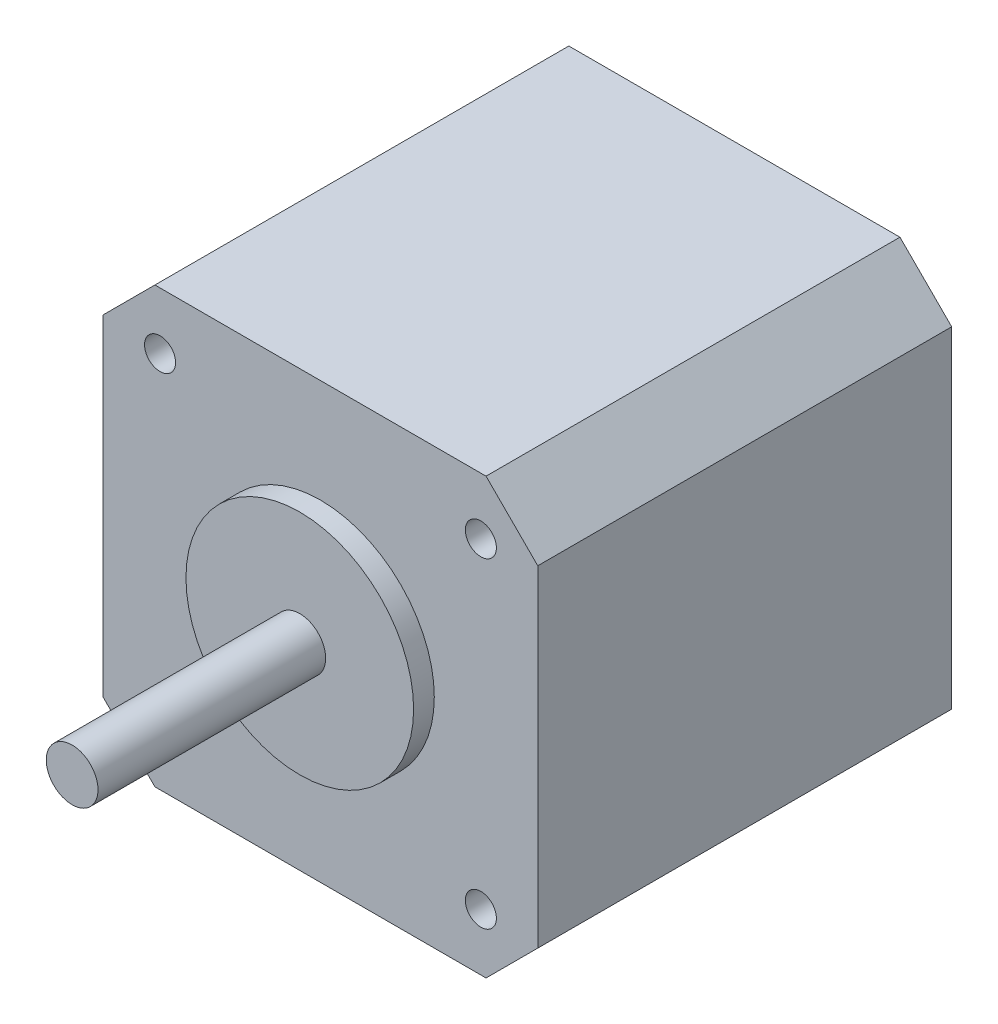
from build123d import *

# Parameters (mm, degrees)
SKETCH_1_W          = 42
SKETCH_1_H          = 42
EXTRUDE_1_DEPTH     = 40
SKETCH_2_R          = 11
EXTRUDE_2_DEPTH     = 2
SKETCH_3_R          = 2.5
EXTRUDE_5_DEPTH     = 22
SKETCH_4_R          = 1.5
CUT_EXTRUDE_1_DEPTH = 31.5
CHAMFER_2_SIZE      = 5


with BuildPart() as part:
    # ｽｹｯﾁ1 → ﾎﾞｽ - 押し出し1 (new body)
    with BuildSketch(Plane.XY):
        Rectangle(SKETCH_1_W, SKETCH_1_H)
    extrude(amount=EXTRUDE_1_DEPTH)

    # ｽｹｯﾁ2 → ﾎﾞｽ - 押し出し2 (add)
    with BuildSketch(Plane.XY.offset(40)):
        Circle(SKETCH_2_R)
    extrude(amount=EXTRUDE_2_DEPTH)

    # ｽｹｯﾁ3 → ﾎﾞｽ - 押し出し5 (add)
    with BuildSketch(Plane.XY.offset(42)):
        Circle(SKETCH_3_R)
    extrude(amount=EXTRUDE_5_DEPTH)

    # ｽｹｯﾁ4 → ｶｯﾄ - 押し出し1 (cut)
    with BuildSketch(Plane.XY.offset(40)):
        with Locations((-15.5, 15.5)):
            Circle(SKETCH_4_R)
        with Locations((15.5, 15.5)):
            Circle(SKETCH_4_R)
        with Locations((15.5, -15.5)):
            Circle(SKETCH_4_R)
        with Locations((-15.5, -15.5)):
            Circle(SKETCH_4_R)
    extrude(amount=-CUT_EXTRUDE_1_DEPTH, mode=Mode.SUBTRACT)

    # 面取り2
    chamfer_2_edges = [part.edges().sort_by_distance(p)[0] for p in [
        (21, -21, 20),
        (-21, -21, 20),
        (-21, 21, 20),
        (21, 21, 20),
    ]]
    chamfer(chamfer_2_edges, length=CHAMFER_2_SIZE)


solid = part.part
